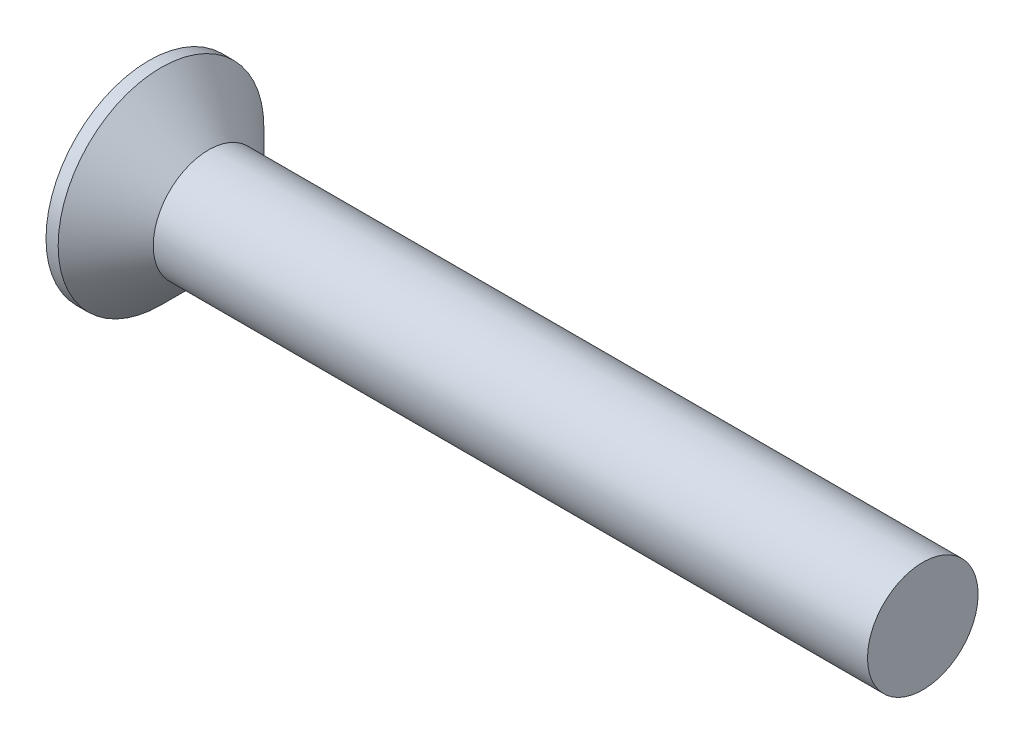
from build123d import *


with BuildPart() as part:
    # Esquisse1 → Révolution1 (revolve)
    with BuildSketch(Plane.XY, mode=Mode.PRIVATE) as r_volution1_sk:
        Polygon((0, 0), (35, 0), (35, 2.5), (2.7, 2.5), (0.55, 4.65), (0, 4.65), align=None)
    revolve(r_volution1_sk.sketch.rotate(Axis((0, 0, 0), (1, 0, 0)), 90), axis=Axis((0, 0, 0), (1, 0, 0)))


solid = part.part
